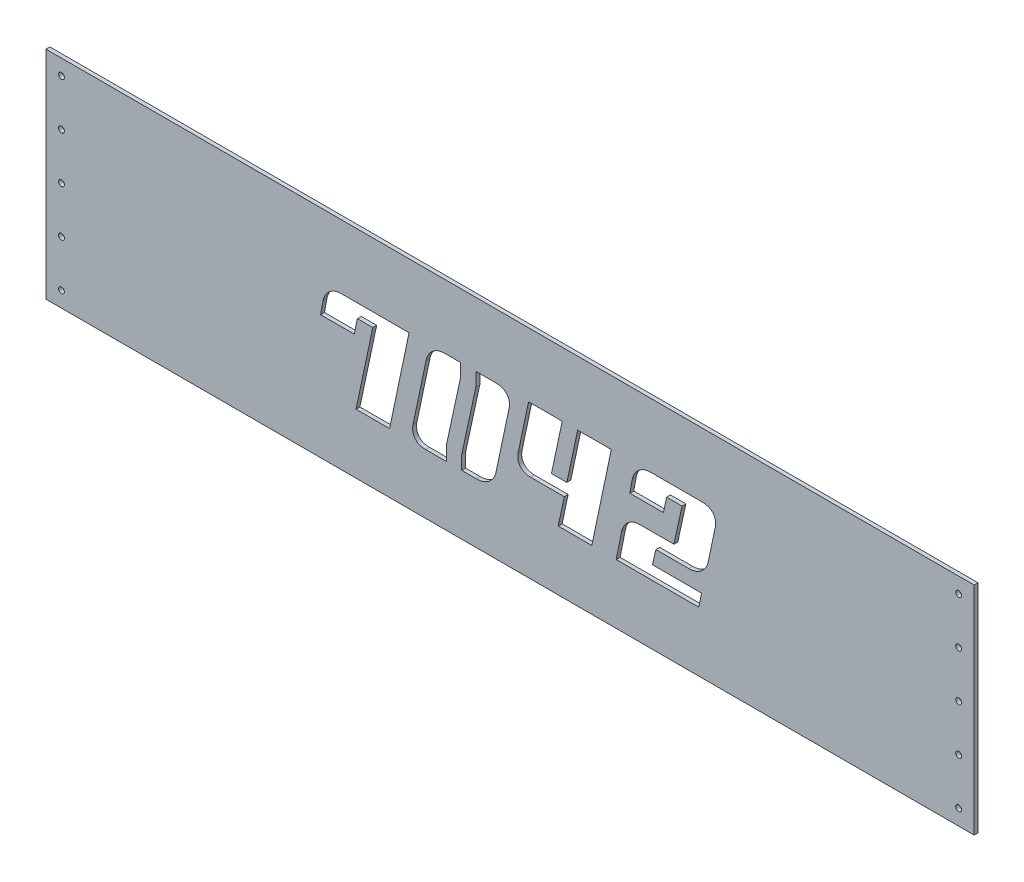
from build123d import *

# Parameters (mm, degrees)
SKETCH1_W             = 762
SKETCH1_H             = 177.8
BOSS_EXTRUDE1_DEPTH   = 3.175
BOSS_EXTRUDE1_2_DEPTH = 3.175
SKETCH2_W             = 12.7
SKETCH2_H             = 25.198455275
SKETCH2_W_2           = 12.652375
SKETCH2_H_2           = 20.883441122
BOSS_EXTRUDE2_DEPTH   = 3.175
SKETCH3_R             = 2.413
CUT_EXTRUDE1_DEPTH    = 392.247096756


with BuildPart() as part:
    # Sketch1 → Boss-Extrude1 (new body)
    with BuildSketch(Plane.XY):
        Rectangle(SKETCH1_W, SKETCH1_H)
        with BuildLine():
            Line((-98.898075, -39.835315096), (-126.47295, -39.835315096))
            Line((-126.47295, -39.835315096), (-112.69345, 25.109309904))
            Line((-112.69345, 25.109309904), (-125.39345, 25.109309904))
            Line((-125.39345, 25.109309904), (-127.981075, 12.822059904))
            Line((-127.981075, 12.822059904), (-155.55595, 12.822059904))
            Line((-155.55595, 12.822059904), (-153.4922, 24.061559904))
            add(Edge.make_bspline(
                [(-153.4922, 24.061559904), (-153.114009041, 25.826838845), (-152.107111159, 28.330892524), (-150.018844738, 31.208697921), (-148.110526346, 33.000169059), (-145.952379495, 34.474150169), (-142.756393957, 35.899752111), (-140.131656162, 36.29243254), (-138.3792, 36.285309904)],
                knots=[0, 0, 0, 0, 0.256781092, 0.379270402, 0.504103305, 0.627938883, 0.75015623, 1, 1, 1, 1], degree=3))
            Line((-138.3792, 36.285309904), (-82.9437, 36.285309904))
            Line((-82.9437, 36.285309904), (-98.898075, -39.835315096))
        make_face(mode=Mode.SUBTRACT)
        with BuildLine():
            Line((-27.695525, -39.914690096), (-69.478525, -39.914690096))
            add(Edge.make_bspline(
                [(-69.478525, -39.914690096), (-70.378419778, -39.890724934), (-71.704855295, -39.834182103), (-73.367269691, -39.428139507), (-74.4978262, -39.054475963), (-75.523062052, -38.544153837), (-76.467505593, -37.933458517), (-77.303402375, -37.199179804), (-78.055411522, -36.372825302), (-78.694544311, -35.450572391), (-79.192076882, -34.444787097), (-79.609552025, -33.388191923), (-79.846110554, -32.250761591), (-80.002676754, -31.050614438), (-79.979776999, -29.310279003), (-79.819248509, -27.981119838), (-79.62265, -27.087690096)],
                knots=[0, 0, 0, 0, 0.140211227, 0.204364429, 0.265147851, 0.324658092, 0.381613589, 0.439257912, 0.496831965, 0.554704074, 0.612744983, 0.670716103, 0.730497823, 0.792544611, 0.858256418, 1, 1, 1, 1], degree=3))
            Line((-79.62265, -27.087690096), (-68.8594, 23.871059904))
            add(Edge.make_bspline(
                [(-68.8594, 23.871059904), (-68.462815939, 25.643057301), (-67.505422501, 28.206697467), (-65.384523981, 31.101105561), (-63.495671972, 32.940400282), (-61.340054695, 34.44245551), (-58.13780239, 35.889129542), (-55.506378001, 36.299143413), (-53.7464, 36.285309904)],
                knots=[0, 0, 0, 0, 0.257514098, 0.38084006, 0.505341434, 0.629198731, 0.750909855, 1, 1, 1, 1], degree=3))
            Line((-53.7464, 36.285309904), (-11.9634, 36.285309904))
            add(Edge.make_bspline(
                [(-11.9634, 36.285309904), (-10.951206406, 36.265095396), (-9.472034389, 36.198930496), (-7.598624422, 35.809565279), (-6.362047596, 35.393919508), (-5.226995923, 34.884334314), (-4.209362568, 34.252182113), (-3.309508264, 33.490388009), (-2.517821843, 32.639137402), (-1.849309358, 31.697562392), (-1.305537987, 30.689972363), (-0.888869485, 29.624844052), (-0.618683845, 28.492151076), (-0.479667068, 27.309465242), (-0.461795302, 25.606385314), (-0.640427295, 24.310954775), (-0.8509, 23.442434904)],
                knots=[0, 0, 0, 0, 0.150988733, 0.2194496, 0.284234088, 0.344880513, 0.404348422, 0.461954929, 0.519942779, 0.577007859, 0.633416367, 0.690044579, 0.746804204, 0.806324292, 0.867001421, 1, 1, 1, 1], degree=3))
            Line((-0.8509, 23.442434904), (-11.61415, -27.532190096))
            add(Edge.make_bspline(
                [(-11.61415, -27.532190096), (-11.987729804, -29.240567183), (-13.011146829, -31.705361087), (-15.153529873, -34.541520304), (-16.794536644, -36.112916543), (-18.285460276, -37.193344942), (-19.453657133, -37.934268454), (-20.694525744, -38.533784236), (-21.977681798, -39.054718418), (-23.334799484, -39.420538407), (-25.229442597, -39.826610751), (-26.705398031, -39.890467006), (-27.695525, -39.914690096)],
                knots=[0, 0, 0, 0, 0.238595474, 0.358933013, 0.483744219, 0.547388327, 0.610400664, 0.672497519, 0.7354808, 0.799354582, 0.864312251, 1, 1, 1, 1], degree=3))
        make_face(mode=Mode.SUBTRACT)
        with BuildLine():
            Line((42.8244, 36.285309904), (33.982025, -5.370690096))
            Line((33.982025, -5.370690096), (46.6344, -5.370690096))
            Line((46.6344, -5.370690096), (55.476775, 36.285309904))
            Line((55.476775, 36.285309904), (83.099275, 36.285309904))
            Line((83.099275, 36.285309904), (67.129025, -39.914690096))
            Line((67.129025, -39.914690096), (39.55415, -39.914690096))
            Line((39.55415, -39.914690096), (44.50715, -16.546690096))
            Line((44.50715, -16.546690096), (16.88465, -16.546690096))
            add(Edge.make_bspline(
                [(16.88465, -16.546690096), (15.97397184, -16.566803466), (14.654465721, -16.442849527), (12.969679896, -16.084165205), (11.848493473, -15.685263746), (10.814508554, -15.187184105), (9.866010852, -14.585783269), (9.028628771, -13.846530809), (8.274838484, -13.021287426), (7.643672663, -12.100509132), (7.126661545, -11.105170566), (6.749218091, -10.040732714), (6.496795936, -8.910572682), (6.345702881, -7.71402033), (6.366723836, -5.974283719), (6.528488375, -4.644730591), (6.72465, -3.751440096)],
                knots=[0, 0, 0, 0, 0.141055917, 0.205006137, 0.266817017, 0.325211674, 0.382839171, 0.440466668, 0.498023916, 0.555879133, 0.613172181, 0.671613009, 0.730576487, 0.792605165, 0.858297791, 1, 1, 1, 1], degree=3))
            Line((6.72465, -3.751440096), (15.186025, 36.285309904))
            Line((15.186025, 36.285309904), (42.8244, 36.285309904))
        make_face(mode=Mode.SUBTRACT)
        with BuildLine():
            Line((116.900325, -28.738690096), (157.1752, -28.738690096))
            Line((157.1752, -28.738690096), (155.000325, -39.914690096))
            Line((155.000325, -39.914690096), (87.1347, -39.914690096))
            Line((87.1347, -39.914690096), (91.5797, -17.800815096))
            add(Edge.make_bspline(
                [(91.5797, -17.800815096), (91.970731994, -16.024994145), (92.943076158, -13.475373477), (95.037802627, -10.562190947), (96.626678786, -9.030826572), (98.04129727, -7.984571288), (99.140031696, -7.270780811), (100.298338787, -6.689209352), (101.495760204, -6.213878956), (102.724230789, -5.824722646), (104.446719435, -5.462579309), (105.778975302, -5.364834977), (106.676825, -5.370690096)],
                knots=[0, 0, 0, 0, 0.257512197, 0.380397285, 0.505435299, 0.568066423, 0.629375226, 0.690688606, 0.751204987, 0.811628551, 0.872900724, 1, 1, 1, 1], degree=3))
            Line((106.676825, -5.370690096), (134.5057, -5.370690096))
            Line((134.5057, -5.370690096), (141.20495, 25.109309904))
            Line((141.20495, 25.109309904), (128.50495, 25.109309904))
            Line((128.50495, 25.109309904), (125.917325, 12.822059904))
            Line((125.917325, 12.822059904), (98.34245, 12.822059904))
            Line((98.34245, 12.822059904), (100.4062, 24.061559904))
            add(Edge.make_bspline(
                [(100.4062, 24.061559904), (100.784390959, 25.826838845), (101.791288841, 28.330892524), (103.879555262, 31.208697921), (105.787873654, 33.000169059), (107.946020505, 34.474150169), (111.142006043, 35.899752111), (113.766743838, 36.29243254), (115.5192, 36.285309904)],
                knots=[0, 0, 0, 0, 0.256781092, 0.379270402, 0.504103305, 0.627938883, 0.75015623, 1, 1, 1, 1], degree=3))
            Line((115.5192, 36.285309904), (157.3022, 36.285309904))
            add(Edge.make_bspline(
                [(157.3022, 36.285309904), (158.313404759, 36.262334312), (159.795356307, 36.203930585), (161.662996805, 35.803296989), (162.915290146, 35.415626042), (164.04161951, 34.88092493), (165.077257642, 34.2714369), (165.971103509, 33.504855616), (166.764093589, 32.655469989), (167.431275951, 31.713004044), (167.97575393, 30.713137791), (168.378470101, 29.644245275), (168.643854599, 28.518162675), (168.787088091, 27.33606961), (168.802987002, 25.638048994), (168.625616664, 24.342751641), (168.4147, 23.474184904)],
                knots=[0, 0, 0, 0, 0.151086534, 0.219591746, 0.284173196, 0.345905024, 0.404997354, 0.462641174, 0.520666586, 0.577768628, 0.634213675, 0.689860087, 0.747422966, 0.80619884, 0.866915273, 1, 1, 1, 1], degree=3))
            Line((168.4147, 23.474184904), (162.60445, -4.195940096))
            add(Edge.make_bspline(
                [(162.60445, -4.195940096), (162.222762109, -5.895405939), (161.212748067, -8.357775045), (159.060484323, -11.176073851), (157.423570654, -12.736969042), (155.946992387, -13.829638667), (154.777335182, -14.570198188), (153.527544548, -15.162182906), (152.245499952, -15.683808477), (150.890272205, -16.057436379), (148.993426207, -16.45398034), (147.513691649, -16.524751422), (146.523075, -16.546690096)],
                knots=[0, 0, 0, 0, 0.238188423, 0.358091, 0.48305048, 0.546187513, 0.609274708, 0.67209543, 0.735153534, 0.798406705, 0.864151056, 1, 1, 1, 1], degree=3))
            Line((146.523075, -16.546690096), (119.67845, -16.546690096))
            Line((119.67845, -16.546690096), (116.900325, -28.738690096))
        make_face(mode=Mode.SUBTRACT)
    extrude(amount=BOSS_EXTRUDE1_DEPTH)



with BuildPart() as body_2:
    # Sketch1 → Boss-Extrude1 2 (new body)
    with BuildSketch(Plane.XY):
        Polygon((-40.76065, 25.109309904), (-52.365275, -28.738690096), (-39.7129, -28.738690096), (-28.06065, 25.109309904), align=None)
    extrude(amount=BOSS_EXTRUDE1_2_DEPTH)


with BuildPart() as part_1:
    add(part.part)

    add(body_2.part)  # Boss-Extrude2 merges body 2
    # Sketch2 → Boss-Extrude2 (add)
    with BuildSketch(Plane.XY.offset(3.175)):
        with Locations((-34.41065, 37.708537542)):
            Rectangle(SKETCH2_W, SKETCH2_H)
        with Locations((-46.0390875, -39.180410657)):
            Rectangle(SKETCH2_W_2, SKETCH2_H_2)
    extrude(amount=-BOSS_EXTRUDE2_DEPTH)

    # Sketch3 → Cut-Extrude1 (cut, through all)
    with BuildSketch(Plane.XY.offset(3.175)):
        with Locations((-368.3, 76.2)):
            Circle(SKETCH3_R)
        with Locations((-368.3, 38.1)):
            Circle(SKETCH3_R)
        with Locations((-368.3, 0)):
            Circle(SKETCH3_R)
        with Locations((-368.3, -38.1)):
            Circle(SKETCH3_R)
        with Locations((-368.3, -76.2)):
            Circle(SKETCH3_R)
        with Locations(Location((368.3, -76.2, 0), (0, 0, 180))):
            Circle(SKETCH3_R)
        with Locations(Location((368.3, -38.1, 0), (0, 0, 180))):
            Circle(SKETCH3_R)
        with Locations(Location((368.3, 0, 0), (0, 0, 180))):
            Circle(SKETCH3_R)
        with Locations(Location((368.3, 38.1, 0), (0, 0, 180))):
            Circle(SKETCH3_R)
        with Locations(Location((368.3, 76.2, 0), (0, 0, 180))):
            Circle(SKETCH3_R)
    extrude(amount=-CUT_EXTRUDE1_DEPTH, mode=Mode.SUBTRACT)


solid = part_1.part
